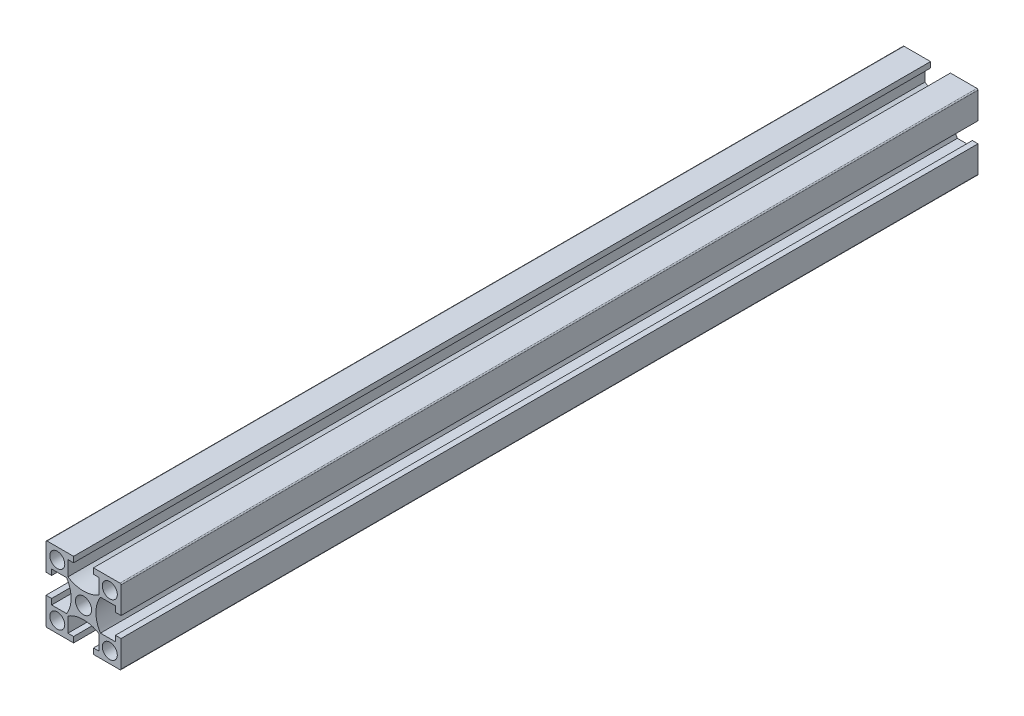
from build123d import *

# Parameters (mm, degrees)
SKETCH_1_W               = 20
SKETCH_1_H               = 20
SKETCH_1_R               = 2
SKETCH_1_R_2             = 2.15
EXTRUDE_1_DEPTH          = 345
CUT_EXTRUDE_1_REACH      = 347.29
PATTERN_CIRCULAR_1_COUNT = 4
FILLET_1_R               = 0.3
CUT_EXTRUDE_2_DEPTH      = 346.289733412
CUT_EXTRUDE_2_DEPTH_BACK = 346.289733412
SKETCH_2_R               = 2.5
SKETCH_4_R               = 2.5
SKETCH_4_R_2             = 2.15
CUT_EXTRUDE_3_DEPTH      = 346.723878361
SKETCH_6_R               = 2.15
SKETCH_6_R_2             = 1.97965
CUT_EXTRUDE_4_DEPTH      = 346.723878361
SKETCH_7_W               = 20
SKETCH_7_H               = 116.62
CUT_EXTRUDE_5_DEPTH      = 346.723878361


with BuildPart() as part:
    # 스케치1 → 보스-돌출1 (new body)
    with BuildSketch(Plane.XY):
        Rectangle(SKETCH_1_W, SKETCH_1_H)
        with Locations((-7, -7)):
            Circle(SKETCH_1_R, mode=Mode.SUBTRACT)
        with Locations((7, -7)):
            Circle(SKETCH_1_R, mode=Mode.SUBTRACT)
        with Locations((-7, 7)):
            Circle(SKETCH_1_R, mode=Mode.SUBTRACT)
        Circle(SKETCH_1_R_2, mode=Mode.SUBTRACT)
        with Locations((7, 7)):
            Circle(SKETCH_1_R, mode=Mode.SUBTRACT)
    extrude(amount=EXTRUDE_1_DEPTH)

    # 스케치1<3> → 컷-돌출1 (cut, up to next)
    with BuildSketch(Plane.XY, mode=Mode.PRIVATE) as cut_extrude_1_sk1:
        with BuildLine():
            Line((-8.5, 2.65), (-10, 2.65))
            Line((-10, 2.65), (-10, -2.65))
            Line((-10, -2.65), (-8.5, -2.65))
            Line((-8.5, -2.65), (-8.5, -4.15))
            Line((-8.5, -4.15), (-4.503166667, -4.15))
            ThreePointArc((-4.503166667, -4.15), (-3.3, 0), (-4.503166667, 4.15))
            Line((-4.503166667, 4.15), (-8.5, 4.15))
            Line((-8.5, 4.15), (-8.5, 2.65))
        make_face()
    cut_extrude_1_tool1 = extrude(cut_extrude_1_sk1.sketch, amount=CUT_EXTRUDE_1_REACH, mode=Mode.PRIVATE) & part.part
    cut_extrude_1 = cut_extrude_1_tool1.solids().sort_by_distance((-6.606913, 0, 0))[0]
    add(cut_extrude_1, mode=Mode.SUBTRACT)

    # 원형 패턴1: 컷-돌출1 ×4 about axis
    pattern_circular_1_axis = Axis((0, 0, 345), (0, 0, -1))
    for i in range(1, PATTERN_CIRCULAR_1_COUNT):
        add(cut_extrude_1.rotate(pattern_circular_1_axis, i * 360 / PATTERN_CIRCULAR_1_COUNT), mode=Mode.SUBTRACT)

    # 필렛1
    fillet_1_edges = [part.edges().sort_by_distance(p)[0] for p in [
        (10, -10, 172.5),
        (-10, -10, 172.5),
        (-10, 10, 172.5),
        (10, 10, 172.5),
    ]]
    fillet(fillet_1_edges, radius=FILLET_1_R)

    # 스케치2 → 컷-돌출2 (cut, two sides: drawn at the far end of the back side and taken through both)
    with BuildSketch(Plane(origin=(0, 0, 0), x_dir=(0, 0, -1), z_dir=(1, 0, 0)).offset(-CUT_EXTRUDE_2_DEPTH_BACK)):
        with Locations((-25, 0)):
            Circle(SKETCH_2_R)
    extrude(amount=CUT_EXTRUDE_2_DEPTH + CUT_EXTRUDE_2_DEPTH_BACK, mode=Mode.SUBTRACT)

    # 스케치4 → 컷-돌출3 (cut, through all)
    with BuildSketch(Plane(origin=(0, 10, 0), x_dir=(1, 0, 0), z_dir=(0, 1, 0))):
        with Locations((0, -334)):
            Circle(SKETCH_4_R)
        with Locations((0, -127.62)):
            Circle(SKETCH_4_R)
        with Locations((0, -85.62)):
            Circle(SKETCH_4_R)
        with Locations((0, -303)):
            Circle(SKETCH_4_R_2)
    extrude(amount=-CUT_EXTRUDE_3_DEPTH, mode=Mode.SUBTRACT)

    # 스케치6 → 컷-돌출4 (cut, through all)
    with BuildSketch(Plane(origin=(0, 10, 0), x_dir=(1, 0, 0), z_dir=(0, 1, 0))):
        with Locations((0, -236.9)):
            Circle(SKETCH_6_R)
        with Locations((0, -184.9)):
            Circle(SKETCH_6_R)
        with Locations((0, -10.15)):
            Circle(SKETCH_6_R_2)
        with Locations((0, -62.15)):
            Circle(SKETCH_6_R)
    extrude(amount=-CUT_EXTRUDE_4_DEPTH, mode=Mode.SUBTRACT)

    # 스케치7 → 컷-돌출5 (cut, through all)
    with BuildSketch(Plane(origin=(0, 10, 0), x_dir=(1, 0, 0), z_dir=(0, 1, 0))):
        with Locations((0, -58.31)):
            Rectangle(SKETCH_7_W, SKETCH_7_H)
    extrude(amount=-CUT_EXTRUDE_5_DEPTH, mode=Mode.SUBTRACT)


solid = part.part
